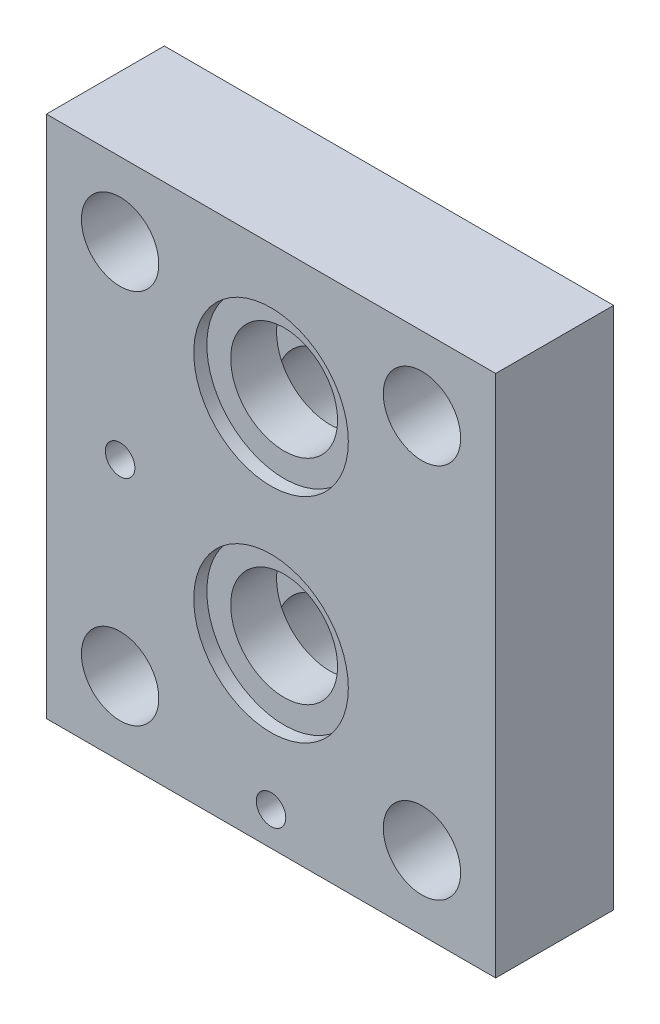
from build123d import *

# Parameters (mm, degrees)
SKETCH1_W                   = 112.776
SKETCH1_H                   = 96.774
BOSS_EXTRUDE1_DEPTH         = 12.7
F_5_8_CLEARANCE_HOLE1_D     = 16.66875
F_5_8_CLEARANCE_HOLE1_DEPTH = 25.4
F_5_8_CLEARANCE_HOLE1_TIP   = 5.007797722
CUT_EXTRUDE2_START          = -12.7
SKETCH4_R                   = 11.509375
CUT_EXTRUDE2_DEPTH          = 12.7
CUT_EXTRUDE4_START          = 12.7
SKETCH5_R                   = 11.509375
CUT_EXTRUDE4_DEPTH          = 12.7
CUT_EXTRUDE6_START          = 12.7
SKETCH6_R                   = 16.6497
CUT_EXTRUDE6_DEPTH          = 2.8194
F_1_4_CLEARANCE_HOLE2_D     = 7.14375
F_1_4_CLEARANCE_HOLE2_DEPTH = 7.874
F_1_4_CLEARANCE_HOLE2_TIP   = 2.146199024
CUT_EXTRUDE8_START          = 12.7
SKETCH11_R                  = 3.175
CUT_EXTRUDE8_DEPTH          = 7.874


with BuildPart() as part:
    # Sketch1 → Boss-Extrude1 (new, symmetric)
    with BuildSketch(Plane(origin=(0, 0, 0), x_dir=(0, 1, 0), z_dir=(0, 0, 1))):
        Rectangle(SKETCH1_W, SKETCH1_H)
    extrude(amount=BOSS_EXTRUDE1_DEPTH, both=True)

    # 5/8 Clearance Hole1
    with Locations(Plane(origin=(0, 0, -12.7), x_dir=(-1, 0, 0), z_dir=(0, 0, -1))):
        with Locations((-32.512, -40.513), (-32.512, 40.513), (32.512, -40.513), (32.512, 40.513)):
            Hole(F_5_8_CLEARANCE_HOLE1_D / 2, depth=F_5_8_CLEARANCE_HOLE1_DEPTH)
            with Locations((0, 0, -(F_5_8_CLEARANCE_HOLE1_DEPTH + F_5_8_CLEARANCE_HOLE1_TIP / 2))):  # 118° drill point
                Cone(0, F_5_8_CLEARANCE_HOLE1_D / 2, F_5_8_CLEARANCE_HOLE1_TIP, mode=Mode.SUBTRACT)

    # Sketch4 → Cut-Extrude2 (cut)
    with BuildSketch(Plane(origin=(0, 0, 0), x_dir=(0, 1, 0), z_dir=(0, 0, 1)).offset(CUT_EXTRUDE2_START)):
        with Locations(Location((-27.813, 0, 0), (0, 0, 270))):
            Circle(SKETCH4_R)
        with Locations(Location((18.161, 0, 0), (0, 0, 270))):
            Circle(SKETCH4_R)
    extrude(amount=CUT_EXTRUDE2_DEPTH, mode=Mode.SUBTRACT)

    # Sketch5 → Cut-Extrude4 (cut)
    with BuildSketch(Plane(origin=(0, 0, 0), x_dir=(0, 1, 0), z_dir=(0, 0, 1)).offset(CUT_EXTRUDE4_START)):
        with Locations(Location((-18.161, 0, 0), (0, 0, 270))):
            Circle(SKETCH5_R)
        with Locations(Location((27.813, 0, 0), (0, 0, 270))):
            Circle(SKETCH5_R)
    extrude(amount=-CUT_EXTRUDE4_DEPTH, mode=Mode.SUBTRACT)

    # Sketch6 → Cut-Extrude6 (cut)
    with BuildSketch(Plane(origin=(0, 0, 0), x_dir=(0, 1, 0), z_dir=(0, 0, 1)).offset(CUT_EXTRUDE6_START)):
        with Locations(Location((-18.161, 0, 0), (0, 0, 270))):
            Circle(SKETCH6_R)
        with Locations(Location((27.813, 0, 0), (0, 0, 270))):
            Circle(SKETCH6_R)
    extrude(amount=-CUT_EXTRUDE6_DEPTH, mode=Mode.SUBTRACT)

    # 1/4 Clearance Hole2
    with Locations(Plane(origin=(0, 0, -12.7), x_dir=(-1, 0, 0), z_dir=(0, 0, -1))):
        with Locations((0, 49.149), (-32.512, 0.127)):
            Hole(F_1_4_CLEARANCE_HOLE2_D / 2, depth=F_1_4_CLEARANCE_HOLE2_DEPTH)
            with Locations((0, 0, -(F_1_4_CLEARANCE_HOLE2_DEPTH + F_1_4_CLEARANCE_HOLE2_TIP / 2))):  # 118° drill point
                Cone(0, F_1_4_CLEARANCE_HOLE2_D / 2, F_1_4_CLEARANCE_HOLE2_TIP, mode=Mode.SUBTRACT)

    # Sketch11 → Cut-Extrude8 (cut)
    with BuildSketch(Plane(origin=(0, 0, 0), x_dir=(0, 1, 0), z_dir=(0, 0, 1)).offset(CUT_EXTRUDE8_START)):
        with Locations(Location((-49.149, 0, 0), (0, 0, 270))):
            Circle(SKETCH11_R)
        with Locations(Location((-0.127, 32.512, 0), (0, 0, 270))):
            Circle(SKETCH11_R)
    extrude(amount=-CUT_EXTRUDE8_DEPTH, mode=Mode.SUBTRACT)


solid = part.part
